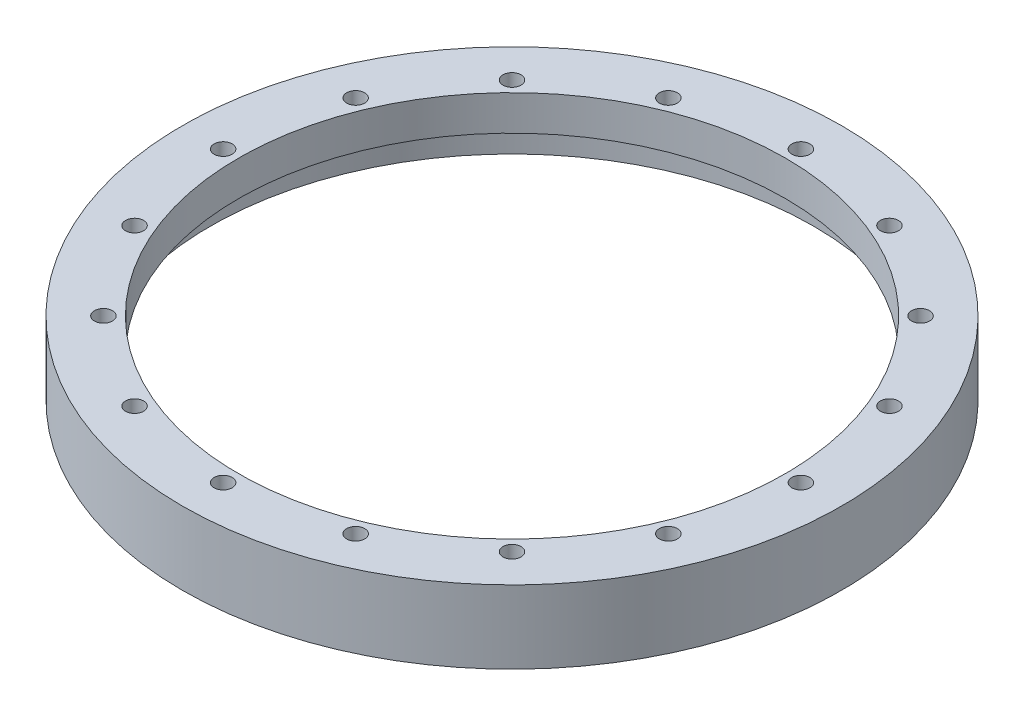
from build123d import *

# Parameters (mm, degrees)
CIRPATTERN1_COUNT = 16


with BuildPart() as part:
    # Sketch1 → Revolve1 (revolve)
    with BuildSketch(Plane.XY, mode=Mode.PRIVATE) as revolve1_sk:
        Polygon((-49.4665, 0), (-59.6265, 0), (-59.6265, -13.208), (-54.5465, -13.208), (-54.5465, -6.35), (-49.4665, -6.35), align=None)
    revolve(revolve1_sk.sketch.rotate(Axis((0, 0, 0), (0, 1, 0)), 270), axis=Axis((0, 0, 0), (0, 1, 0)))

    # Sketch3 → #4 Clearance Hole1 (revolve, cut)
    with BuildSketch(Plane(origin=(0, 0, -52.26812), x_dir=(0, 0, 1), z_dir=(1, 0, 0))):
        Polygon((0, 0), (0, 11.140574487), (1.63195, 10.16), (1.63195, 0), align=None)
    f_4_clearance_hole1 = revolve(axis=Axis((0, 6.35, -52.26812), (0, -1, 0)), mode=Mode.SUBTRACT)

    # CirPattern1: #4 Clearance Hole1 ×16 about axis
    cirpattern1_axis = Axis((0, 0, 0), (0, 1, 0))
    for i in range(1, CIRPATTERN1_COUNT):
        add(f_4_clearance_hole1.rotate(cirpattern1_axis, i * 360 / CIRPATTERN1_COUNT), mode=Mode.SUBTRACT)


solid = part.part
